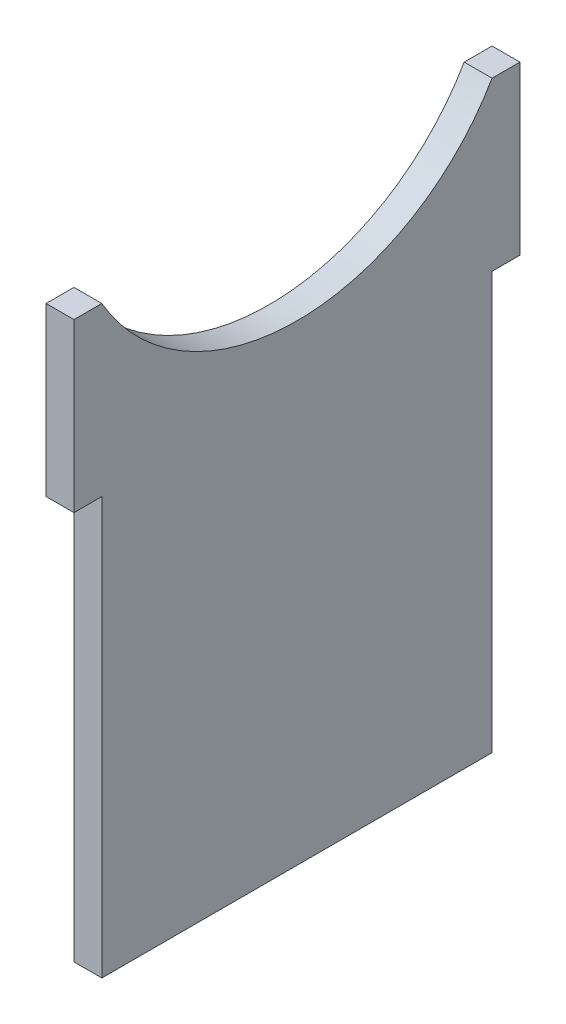
from build123d import *

# Parameters (mm, degrees)
BOSS_EXTRUDE1_DEPTH = 1.5875


with BuildPart() as part:
    # Sketch1 → Boss-Extrude1 (new body)
    with BuildSketch(Plane(origin=(0, 0, 0), x_dir=(0, 0, -1), z_dir=(1, 0, 0))):
        with BuildLine():
            Line((-11.1125, -15.940804866), (-11.1125, -39.6875))
            Line((-11.1125, -39.6875), (11.1125, -39.6875))
            Line((11.1125, -39.6875), (11.1125, -15.940804866))
            Line((11.1125, -15.940804866), (12.7, -15.940804866))
            Line((12.7, -15.940804866), (12.7, -6.415804866))
            Line((12.7, -6.415804866), (11.1125, -6.415804866))
            ThreePointArc((11.1125, -6.415804866), (0, -12.831609733), (-11.1125, -6.415804866))
            Line((-11.1125, -6.415804866), (-12.7, -6.415804866))
            Line((-12.7, -6.415804866), (-12.7, -15.940804866))
            Line((-12.7, -15.940804866), (-11.1125, -15.940804866))
        make_face()
    extrude(amount=BOSS_EXTRUDE1_DEPTH)


solid = part.part
